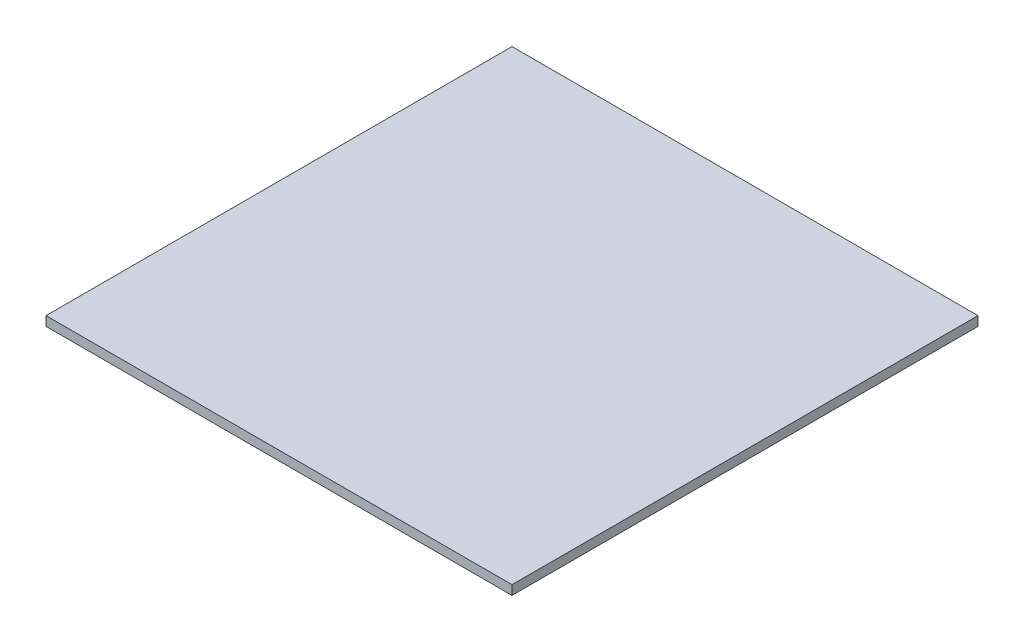
from build123d import *

# Parameters (mm, degrees)
SKETCH_1_W      = 200
SKETCH_1_H      = 200
EXTRUDE_1_DEPTH = 4


with BuildPart() as part:
    # 草图1 → 凸台-拉伸1 (new body)
    with BuildSketch(Plane(origin=(0, 0, 0), x_dir=(1, 0, 0), z_dir=(0, 1, 0))):
        with Locations((100, -100)):
            Rectangle(SKETCH_1_W, SKETCH_1_H)
    extrude(amount=EXTRUDE_1_DEPTH)


solid = part.part
